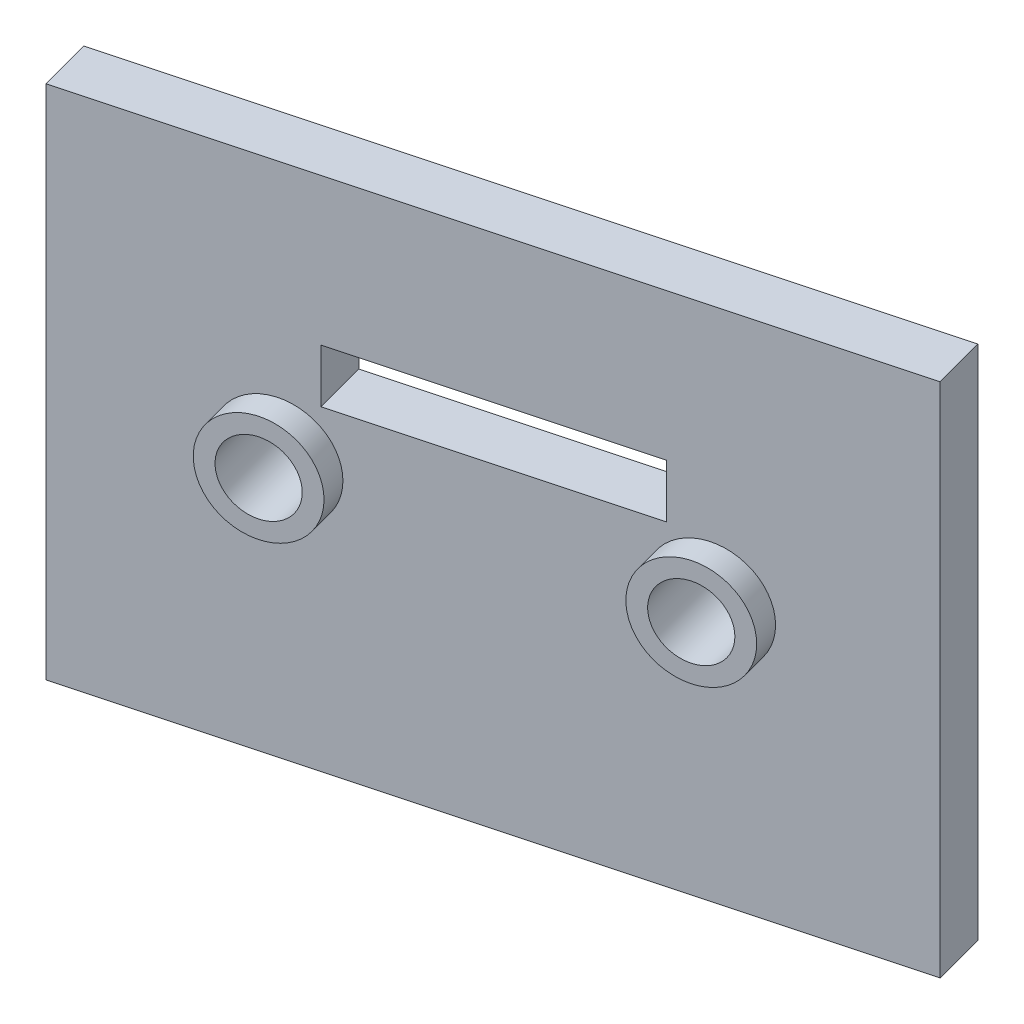
from build123d import *

# Parameters (mm, degrees)
SKETCH1_W                = 41
SKETCH1_H                = 29
BOSS_EXTRUDE1_DEPTH      = 3
SKETCH11_R               = 3
BOSS_EXTRUDE2_DEPTH      = 1.5
F_4_0_4_DIAMETER_HOLE1_D = 4
BODY_MOVE_COPY9_ANGLE    = 15
SKETCH16_W               = 15.840183039
SKETCH16_H               = 12.5
BOSS_EXTRUDE3_DEPTH      = 1
SKETCH17_W               = 15.840183039
SKETCH17_H               = 3
BOSS_EXTRUDE4_DEPTH      = 20


with BuildPart() as part:
    # Sketch1 → Boss-Extrude1 (new body)
    with BuildSketch(Plane.XY):
        Rectangle(SKETCH1_W, SKETCH1_H)
    extrude(amount=BOSS_EXTRUDE1_DEPTH)


with BuildPart() as part_1:
    # Body-Move/Copy1: moved
    add(part.part.moved(Location((0.5, 0.5, 0))))

    # Sketch11 → Boss-Extrude2 (add)
    with BuildSketch(Plane.XY.offset(3)):
        with Locations((-9.387244392, 0.5)):
            Circle(SKETCH11_R)
        with Locations((10.452938647, 0.5)):
            Circle(SKETCH11_R)
    extrude(amount=BOSS_EXTRUDE2_DEPTH)

    # Ø4.0 (4) Diameter Hole1 (through all)
    with Locations(Plane.XY.offset(4.5)):
        with Locations((-9.387244392, 0.5), (10.452938647, 0.5)):
            Hole(F_4_0_4_DIAMETER_HOLE1_D / 2)


with BuildPart() as part_2:
    # Body-Move/Copy8: moved
    add(part_1.part.moved(Location((27.795693281, 0, 0))))


with BuildPart() as part_3:
    # Body-Move/Copy9: moved
    add(part_2.part.rotate(Axis((28.295693281, 0, 2.25), (0, 1, 0)), BODY_MOVE_COPY9_ANGLE))


with BuildPart() as body_2:
    # Sketch16 → Boss-Extrude3 (new body)
    with BuildSketch(Plane(origin=(1.87560919, 0, 6.99986879), x_dir=(-0.9659258262890683, 0, 0.2588190451025207), z_dir=(-0.2588190451025207, 0, -0.9659258262890683))):
        with Locations((-26.78204519, 6.75)):
            Rectangle(SKETCH16_W, SKETCH16_H)
    extrude(amount=BOSS_EXTRUDE3_DEPTH)


with BuildPart() as body_2_1:
    # Body-Move/Copy10: moved
    add(body_2.part.moved(Location((0, -6.25, 0))))


with BuildPart() as body_3:
    # Sketch17 → Boss-Extrude4 (new body)
    with BuildSketch(Plane(origin=(1.616790144, 0, 6.033942964), x_dir=(-0.9659258262890683, 0, 0.25881904510252085), z_dir=(-0.2588190451025208, 0, -0.9659258262890682))):
        with Locations((-26.78204519, 5.25)):
            Rectangle(SKETCH17_W, SKETCH17_H)
    extrude(amount=-BOSS_EXTRUDE4_DEPTH)


with BuildPart() as part_4:
    add(part_3.part)

    # Combine1: cut body 2, body 3
    add(body_2_1.part, mode=Mode.SUBTRACT)
    add(body_3.part, mode=Mode.SUBTRACT)


solid = part_4.part
